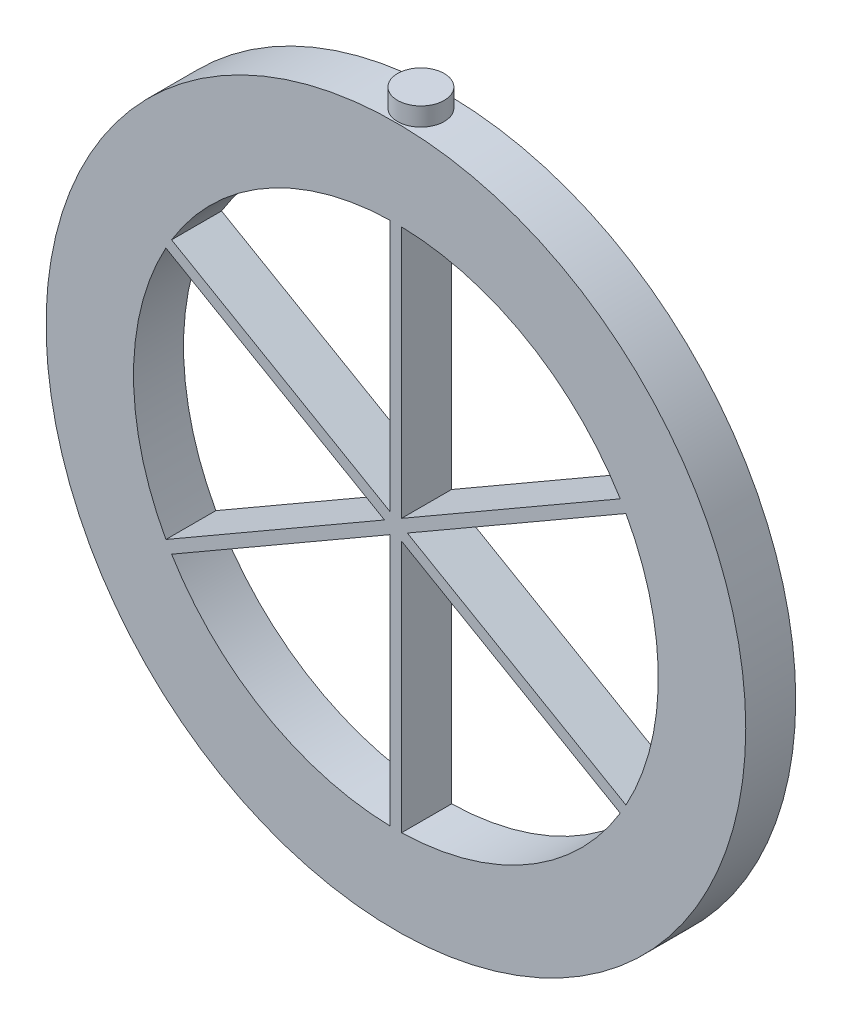
from build123d import *

# Parameters (mm, degrees)
SKETCH_1_R      = 210
EXTRUDE_1_DEPTH = 30
SKETCH_2_R      = 14
EXTRUDE_2_DEPTH = 11.005890415


with BuildPart() as part:
    # 草图1 → 凸台-拉伸1 (new body)
    with BuildSketch(Plane.XY):
        Circle(SKETCH_1_R)
        with BuildLine():
            Line((-134.645818325, -81.711404391), (-3.404633286, -5.93927088))
            Line((-3.404633286, -5.93927088), (-3.404633286, -157.463197199))
            ThreePointArc((-3.404633286, -157.463197199), (-78.73414333, -136.40815472), (-134.645818325, -81.711404391))
        make_face(mode=Mode.SUBTRACT)
        with BuildLine():
            Line((-138.087061144, 75.750996987), (-6.845876106, -0.021136524))
            Line((-6.845876106, -0.021136524), (-138.069445579, -75.783099683))
            ThreePointArc((-138.069445579, -75.783099683), (-157.499998936, -0.018309091), (-138.087061144, 75.750996987))
        make_face(mode=Mode.SUBTRACT)
        Polygon((-3.441242819, -1.986802468), (-3.404633286, -1.965665944), (-3.404633286, -2.007938992), align=None, mode=Mode.SUBTRACT)
        with BuildLine():
            Line((3.441242819, -157.462401378), (3.441242819, -5.918134357))
            Line((3.441242819, -5.918134357), (134.664812292, -81.680097516))
            ThreePointArc((134.664812292, -81.680097516), (78.765855606, -136.389845629), (3.441242819, -157.462401378))
        make_face(mode=Mode.SUBTRACT)
        Polygon((0, -3.931331889), (0.036609533, -3.952468412), (0, -3.973604936), align=None, mode=Mode.SUBTRACT)
        Polygon((3.404633286, -1.965665944), (3.441242819, -1.944529421), (3.441242819, -1.986802468), align=None, mode=Mode.SUBTRACT)
        Polygon((-3.441242819, 1.986802468), (-3.404633286, 1.965665944), (-3.441242819, 1.944529421), align=None, mode=Mode.SUBTRACT)
        Polygon((0, 3.973604936), (0, 3.931331889), (-0.036609533, 3.952468412), align=None, mode=Mode.SUBTRACT)
        with BuildLine():
            Line((-3.441242819, 157.462401378), (-3.441242819, 5.918134357))
            Line((-3.441242819, 5.918134357), (-134.664812292, 81.680097516))
            ThreePointArc((-134.664812292, 81.680097516), (-78.765855606, 136.389845629), (-3.441242819, 157.462401378))
        make_face(mode=Mode.SUBTRACT)
        Polygon((3.441242819, 1.986802468), (3.404633286, 1.965665944), (3.404633286, 2.007938992), align=None, mode=Mode.SUBTRACT)
        with BuildLine():
            Line((138.087061144, -75.750996987), (6.845876106, 0.021136524))
            Line((6.845876106, 0.021136524), (138.069445579, 75.783099683))
            ThreePointArc((138.069445579, 75.783099683), (157.499998936, 0.018309091), (138.087061144, -75.750996987))
        make_face(mode=Mode.SUBTRACT)
        with BuildLine():
            Line((134.645818325, 81.711404391), (3.404633286, 5.93927088))
            Line((3.404633286, 5.93927088), (3.404633286, 157.463197199))
            ThreePointArc((3.404633286, 157.463197199), (78.73414333, 136.40815472), (134.645818325, 81.711404391))
        make_face(mode=Mode.SUBTRACT)
    extrude(amount=EXTRUDE_1_DEPTH)


with BuildPart() as body_2:
    # 草图2 → 凸台-拉伸2 (new body)
    with BuildSketch(Plane(origin=(0, 210, 0), x_dir=(1, 0, 0), z_dir=(0, 1, 0))):
        with Locations(Location((0, -15, 0), (0, 0, 180))):
            Circle(SKETCH_2_R)
    extrude(amount=EXTRUDE_2_DEPTH)


solid = Compound([part.part, body_2.part])
